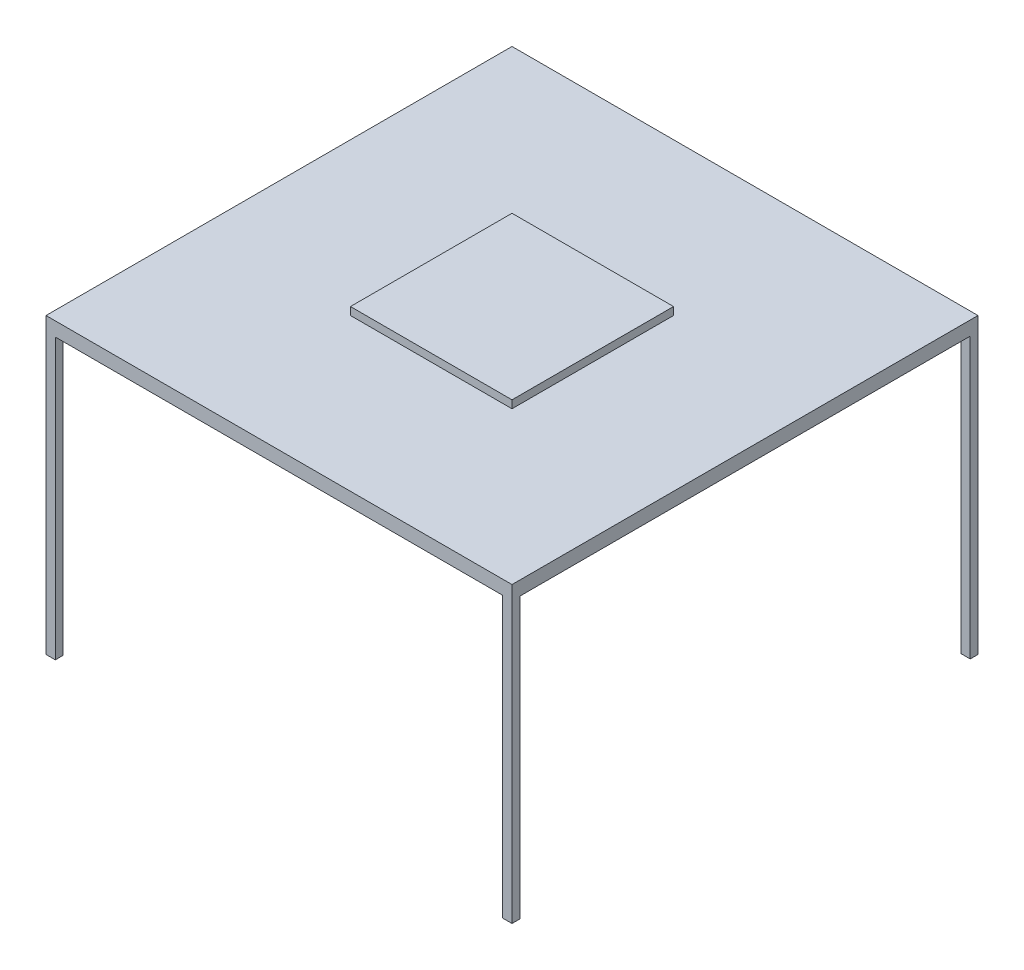
from build123d import *

# Parameters (mm, degrees)
SKETCH1_W           = 520
SKETCH1_H           = 520
BOSS_EXTRUDE1_DEPTH = 25
SKETCH2_W           = 1500
SKETCH2_H           = 1500
BOSS_EXTRUDE2_DEPTH = 45
SKETCH3_W           = 30
SKETCH3_H           = 25
BOSS_EXTRUDE3_DEPTH = 900
SKETCH4_W           = 30
SKETCH4_H           = 25
BOSS_EXTRUDE4_DEPTH = 900
SKETCH5_W           = 30
SKETCH5_H           = 25
BOSS_EXTRUDE5_DEPTH = 900
SKETCH6_W           = 25
SKETCH6_H           = 30
BOSS_EXTRUDE6_DEPTH = 900


with BuildPart() as part:
    # Sketch1 → Boss-Extrude1 (new body)
    with BuildSketch(Plane(origin=(0, 0, 0), x_dir=(1, 0, 0), z_dir=(0, 1, 0))):
        Rectangle(SKETCH1_W, SKETCH1_H)
    extrude(amount=BOSS_EXTRUDE1_DEPTH)

    # Sketch2 → Boss-Extrude2 (add)
    with BuildSketch(Plane.XZ):
        Rectangle(SKETCH2_W, SKETCH2_H)
    extrude(amount=BOSS_EXTRUDE2_DEPTH)

    # Sketch3 → Boss-Extrude3 (add)
    with BuildSketch(Plane.XZ.offset(45)):
        with Locations((735, 737.5)):
            Rectangle(SKETCH3_W, SKETCH3_H)
    extrude(amount=BOSS_EXTRUDE3_DEPTH)

    # Sketch4 → Boss-Extrude4 (add)
    with BuildSketch(Plane.XZ.offset(45)):
        with Locations((-735, 737.5)):
            Rectangle(SKETCH4_W, SKETCH4_H)
    extrude(amount=BOSS_EXTRUDE4_DEPTH)

    # Sketch5 → Boss-Extrude5 (add)
    with BuildSketch(Plane.XZ.offset(45)):
        with Locations((735, -737.5)):
            Rectangle(SKETCH5_W, SKETCH5_H)
    extrude(amount=BOSS_EXTRUDE5_DEPTH)

    # Sketch6 → Boss-Extrude6 (add)
    with BuildSketch(Plane.XZ.offset(45)):
        with Locations((-737.5, -735)):
            Rectangle(SKETCH6_W, SKETCH6_H)
    extrude(amount=BOSS_EXTRUDE6_DEPTH)


solid = part.part
